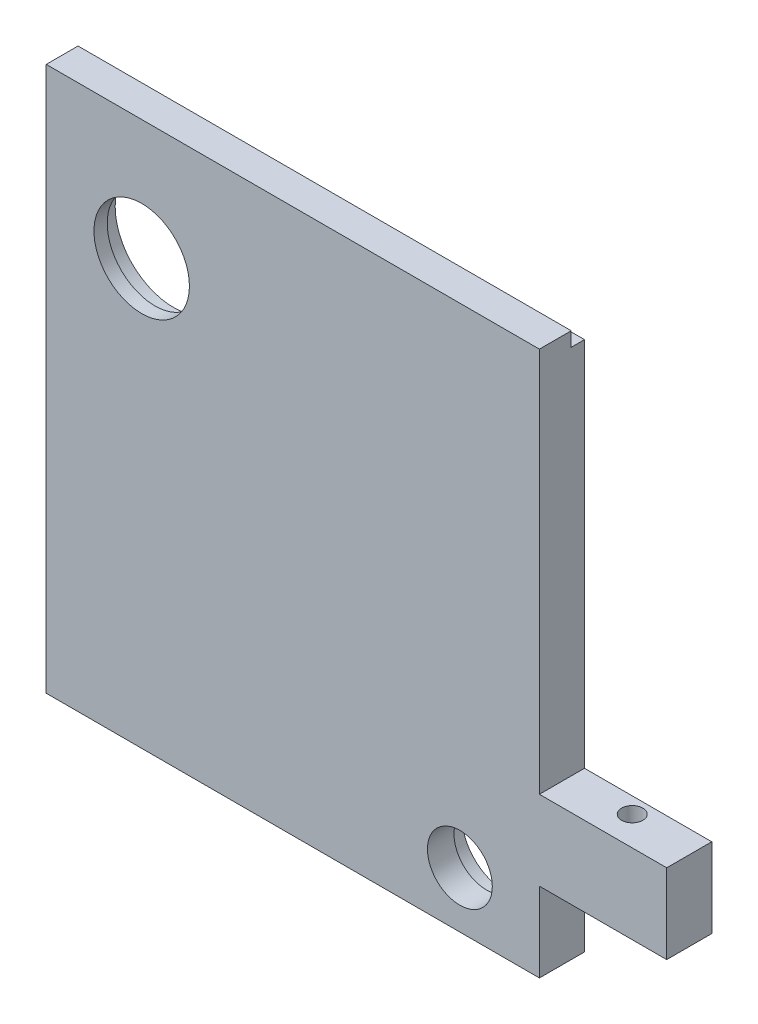
from build123d import *

# Parameters (mm, degrees)
SKETCH1_W           = 93
SKETCH1_H           = 102.7
BOSS_EXTRUDE2_DEPTH = 6
SKETCH3_W           = 35
SKETCH3_H           = 100
BOSS_EXTRUDE3_DEPTH = 2.5
SKETCH4_W           = 8.5
SKETCH4_H           = 15
BOSS_EXTRUDE4_DEPTH = 24
SKETCH5_R           = 2
CUT_EXTRUDE1_DEPTH  = 50
SKETCH6_R           = 8.115
CUT_EXTRUDE2_DEPTH  = 50
SKETCH7_R           = 11
CUT_EXTRUDE3_DEPTH  = 50
EXTRUDE_THIN1_START = -3.5
SKETCH7_AGAIN_R     = 11
SKETCH7_AGAIN_R_2   = 9
EXTRUDE_THIN1_DEPTH = 2.5
EXTRUDE_THIN2_START = -3.5
SKETCH6_2_R         = 8.115
SKETCH6_2_R_2       = 6.115
EXTRUDE_THIN2_DEPTH = 5


with BuildPart() as part:
    # Sketch1 → Boss-Extrude2 (new body)
    with BuildSketch(Plane.XY):
        with Locations((-29.68705036, 16.278057554)):
            Rectangle(SKETCH1_W, SKETCH1_H)
    extrude(amount=BOSS_EXTRUDE2_DEPTH)

    # Sketch3 → Boss-Extrude3 (add)
    with BuildSketch(Plane(origin=(0, 0, 0), x_dir=(-1, 0, 0), z_dir=(0, 0, -1))):
        with Locations((0.68705036, 14.928057554)):
            Rectangle(SKETCH3_W, SKETCH3_H)
    extrude(amount=BOSS_EXTRUDE3_DEPTH)

    # Sketch4 → Boss-Extrude4 (add)
    with BuildSketch(Plane(origin=(16.81294964, 0, 0), x_dir=(0, 0, -1), z_dir=(1, 0, 0))):
        with Locations((-1.75, -12.571942446)):
            Rectangle(SKETCH4_W, SKETCH4_H)
    extrude(amount=BOSS_EXTRUDE4_DEPTH)

    # Sketch5 → Cut-Extrude1 (cut)
    with BuildSketch(Plane(origin=(0, -5.071942446, 0), x_dir=(1, 0, 0), z_dir=(0, 1, 0))):
        with Locations(Location((28.81294964, -0.5, 0), (0, 0, 180))):
            Circle(SKETCH5_R)
    extrude(amount=-CUT_EXTRUDE1_DEPTH, mode=Mode.SUBTRACT)

    # Sketch6 → Cut-Extrude2 (cut)
    with BuildSketch(Plane(origin=(0, 0, -2.5), x_dir=(-1, 0, 0), z_dir=(0, 0, -1))):
        with Locations((-1.81294964, -24.571942446)):
            Circle(SKETCH6_R)
    extrude(amount=-CUT_EXTRUDE2_DEPTH, mode=Mode.SUBTRACT)

    # Sketch7 → Cut-Extrude3 (cut)
    with BuildSketch(Plane(origin=(0, 0, 0), x_dir=(-1, 0, 0), z_dir=(0, 0, -1))):
        with Locations((58.18705036, 44.928057554)):
            Circle(SKETCH7_R)
    extrude(amount=-CUT_EXTRUDE3_DEPTH, mode=Mode.SUBTRACT)

    # Sketch7 again → Extrude-Thin1 (add)
    with BuildSketch(Plane(origin=(0, 0, 0), x_dir=(-1, 0, 0), z_dir=(0, 0, -1)).offset(EXTRUDE_THIN1_START)):
        with Locations((58.18705036, 44.928057554)):
            Circle(SKETCH7_AGAIN_R)
        with Locations((58.18705036, 44.928057554)):
            Circle(SKETCH7_AGAIN_R_2, mode=Mode.SUBTRACT)
    extrude(amount=-EXTRUDE_THIN1_DEPTH)

    # Sketch6<2> → Extrude-Thin2 (add)
    with BuildSketch(Plane(origin=(0, 0, -2.5), x_dir=(-1, 0, 0), z_dir=(0, 0, -1)).offset(EXTRUDE_THIN2_START)):
        with Locations((-1.81294964, -24.571942446)):
            Circle(SKETCH6_2_R)
        with Locations((-1.81294964, -24.571942446)):
            Circle(SKETCH6_2_R_2, mode=Mode.SUBTRACT)
    extrude(amount=-EXTRUDE_THIN2_DEPTH)


solid = part.part
